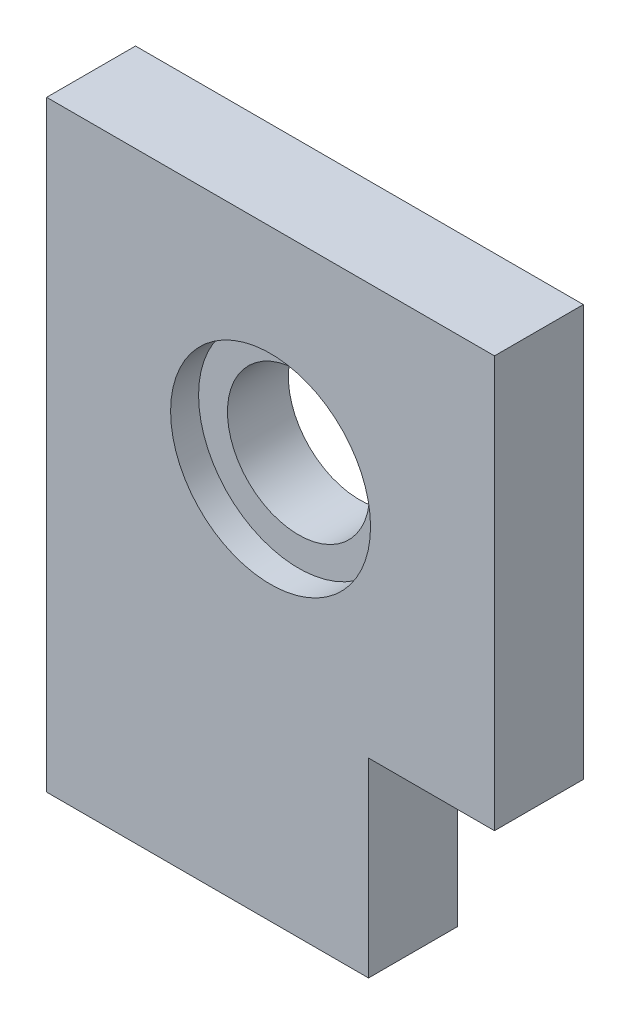
from build123d import *

# Parameters (mm, degrees)
SKETCH1_R           = 10.16
BOSS_EXTRUDE1_DEPTH = 12.7
CUT_EXTRUDE1_START  = 12.7
SKETCH2_R           = 14.2875
CUT_EXTRUDE1_DEPTH  = 4


with BuildPart() as part:
    # Sketch1 → Boss-Extrude1 (new body)
    with BuildSketch(Plane.XY):
        Polygon((14, -56), (-32, -56), (-32, 0), (-32, 30), (32, 30), (32, -28.77498914), (14, -28.77498914), align=None)
        Circle(SKETCH1_R, mode=Mode.SUBTRACT)
    extrude(amount=BOSS_EXTRUDE1_DEPTH)

    # Sketch2 → Cut-Extrude1 (cut)
    with BuildSketch(Plane.XY.offset(CUT_EXTRUDE1_START)):
        Circle(SKETCH2_R)
    extrude(amount=-CUT_EXTRUDE1_DEPTH, mode=Mode.SUBTRACT)


solid = part.part
